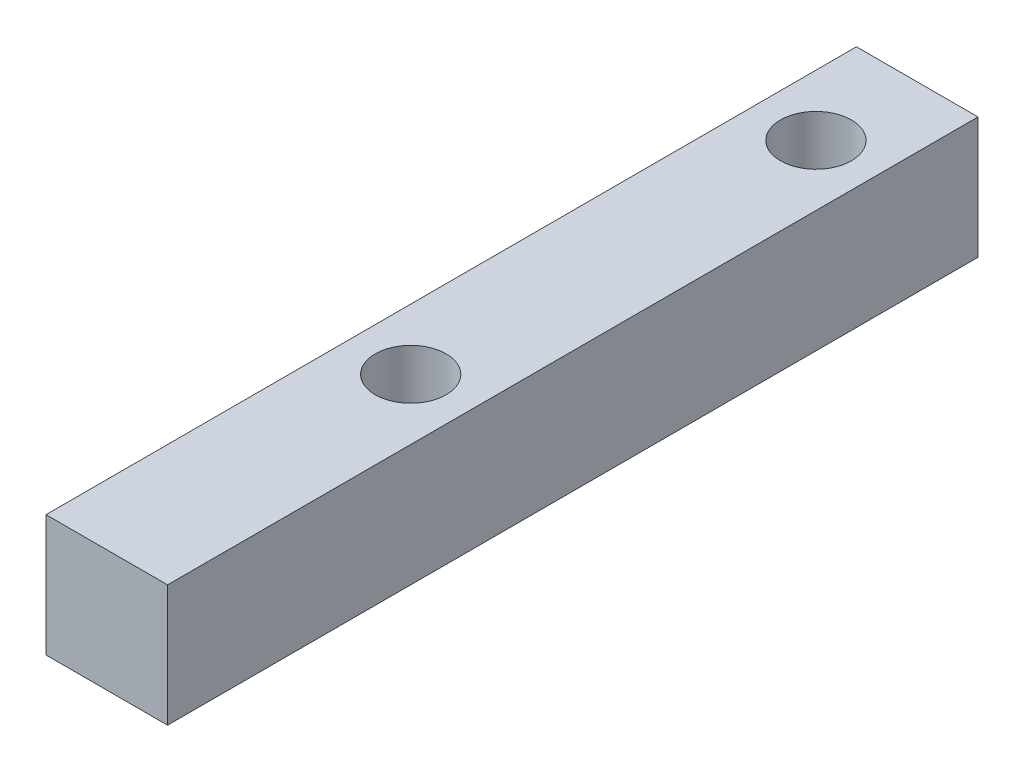
from build123d import *

# Parameters (mm, degrees)
SKETCH_1_W      = 6
SKETCH_1_H      = 40
SKETCH_1_R      = 1.75
EXTRUDE_1_DEPTH = 6


with BuildPart() as part:
    # 草图1 → 凸台-拉伸1 (new body)
    with BuildSketch(Plane(origin=(0, 0, 0), x_dir=(1, 0, 0), z_dir=(0, 1, 0))):
        Rectangle(SKETCH_1_W, SKETCH_1_H)
        with Locations(Location((0, 15, 0), (0, 0, 270))):
            Circle(SKETCH_1_R, mode=Mode.SUBTRACT)
        with Locations(Location((0, -5, 0), (0, 0, 270))):
            Circle(SKETCH_1_R, mode=Mode.SUBTRACT)
    extrude(amount=EXTRUDE_1_DEPTH)


solid = part.part
